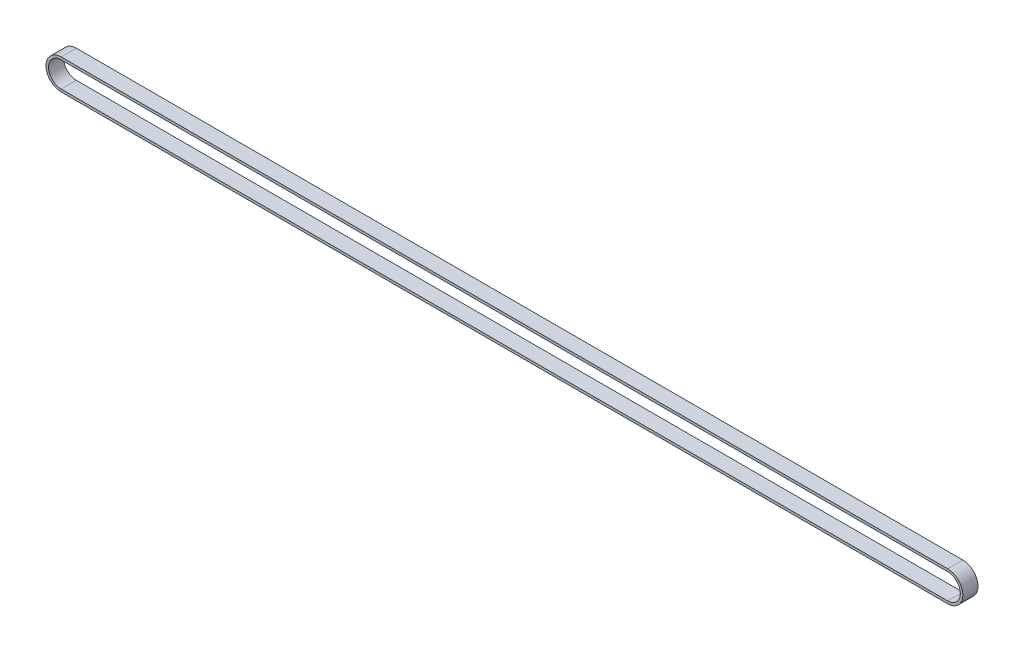
from build123d import *

# Parameters (mm, degrees)
BOSS_EXTRUDE1_DEPTH = 6


with BuildPart() as part:
    # Sketch1 → Boss-Extrude1 (new body)
    with BuildSketch(Plane.XY):
        with BuildLine():
            Line((0, 6), (350.7, 6))
            ThreePointArc((350.7, 6), (356.7, 0), (350.7, -6))
            Line((350.7, -6), (0, -6))
            ThreePointArc((0, -6), (-6, 0), (0, 6))
        make_face()
        with BuildLine():
            Line((0, 5), (350.7, 5))
            ThreePointArc((350.7, 5), (355.7, 0), (350.7, -5))
            Line((350.7, -5), (0, -5))
            ThreePointArc((0, -5), (-5, 0), (0, 5))
        make_face(mode=Mode.SUBTRACT)
    extrude(amount=BOSS_EXTRUDE1_DEPTH)


solid = part.part
